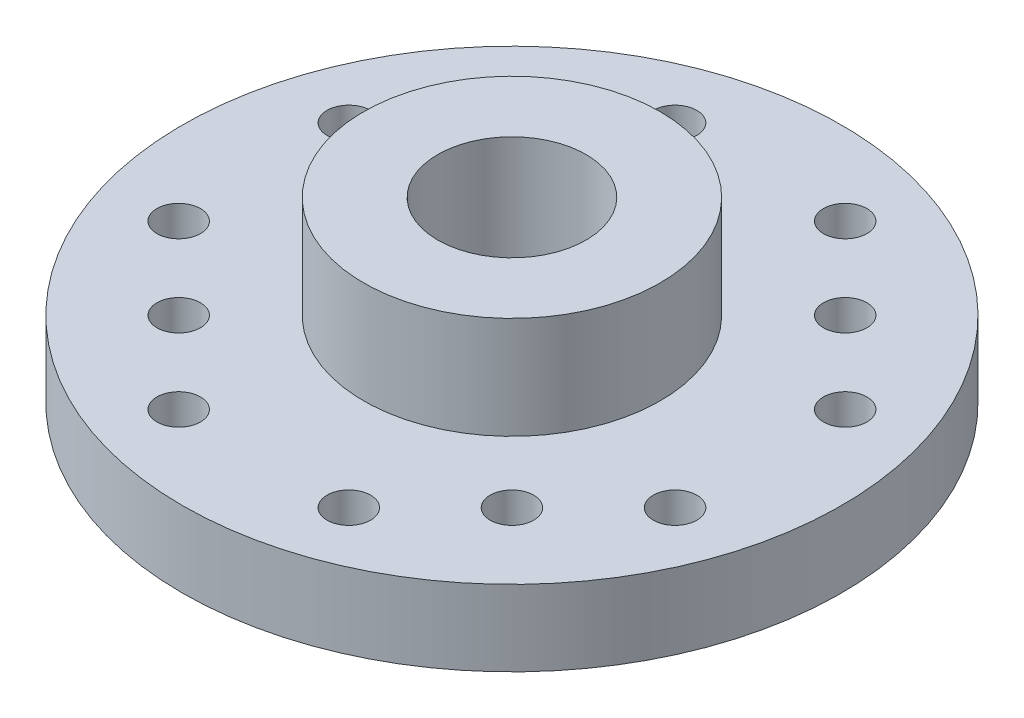
from build123d import *

# Parameters (mm, degrees)
SKETCH1_R           = 10
SKETCH1_R_2         = 0.66
SKETCH1_R_3         = 1.5
BOSS_EXTRUDE1_DEPTH = 2.3
SKETCH2_R           = 4.5
SKETCH2_R_2         = 1.5
BOSS_EXTRUDE2_DEPTH = 3.1
SKETCH3_R           = 2.25
CUT_EXTRUDE1_DEPTH  = 3.6
SKETCH_1_R          = 0.66
CUT_EXTRUDE_1_DEPTH = 16.138031576
SKETCH_2_R          = 4.375
SKETCH_2_R_2        = 3.2
SKETCH_2_R_3        = 2.7
SKETCH_2_R_4        = 1.5
CUT_EXTRUDE_2_DEPTH = 0.8


with BuildPart() as part:
    # Sketch1 → Boss-Extrude1 (new body)
    with BuildSketch(Plane(origin=(0, 0, 0), x_dir=(1, 0, 0), z_dir=(0, 1, 0))):
        with Locations(Location((0, 0, 0), (0, 0, 270))):
            Circle(SKETCH1_R)
        with Locations(Location((-5.055813485, 5.055813485, 0), (0, 0, 270))):
            Circle(SKETCH1_R_2, mode=Mode.SUBTRACT)
        with Locations(Location((5.055813485, 5.055813485, 0), (0, 0, 270))):
            Circle(SKETCH1_R_2, mode=Mode.SUBTRACT)
        with Locations(Location((5.055813485, -5.055813485, 0), (0, 0, 270))):
            Circle(SKETCH1_R_2, mode=Mode.SUBTRACT)
        with Locations(Location((-5.055813485, -5.055813485, 0), (0, 0, 270))):
            Circle(SKETCH1_R_2, mode=Mode.SUBTRACT)
        with Locations(Location((0, 0, 0), (0, 0, 270))):
            Circle(SKETCH1_R_3, mode=Mode.SUBTRACT)
    extrude(amount=BOSS_EXTRUDE1_DEPTH)

    # Sketch2 → Boss-Extrude2 (add)
    with BuildSketch(Plane(origin=(0, 2.3, 0), x_dir=(1, 0, 0), z_dir=(0, 1, 0))):
        with Locations(Location((0, 0, 0), (0, 0, 90))):
            Circle(SKETCH2_R)
        with Locations(Location((0, 0, 0), (0, 0, 270))):
            Circle(SKETCH2_R_2, mode=Mode.SUBTRACT)
    extrude(amount=BOSS_EXTRUDE2_DEPTH)

    # Sketch3 → Cut-Extrude1 (cut)
    with BuildSketch(Plane(origin=(0, 5.4, 0), x_dir=(1, 0, 0), z_dir=(0, 1, 0))):
        with Locations(Location((0, 0, 0), (0, 0, 270))):
            Circle(SKETCH3_R)
    extrude(amount=-CUT_EXTRUDE1_DEPTH, mode=Mode.SUBTRACT)

    # ｽｹｯﾁ1 → ｶｯﾄ - 押し出し1 (cut, through all)
    with BuildSketch(Plane(origin=(0, 0, 0), x_dir=(-1, 0, 0), z_dir=(0, -1, 0))):
        with Locations(Location((-2.580939751, -7.53068722, 0), (0, 0, 90))):
            Circle(SKETCH_1_R)
        with Locations(Location((-7.53068722, -2.580939751, 0), (0, 0, 90))):
            Circle(SKETCH_1_R)
        with Locations(Location((-7.53068722, 2.580939751, 0), (0, 0, 90))):
            Circle(SKETCH_1_R)
        with Locations(Location((-2.580939751, 7.53068722, 0), (0, 0, 90))):
            Circle(SKETCH_1_R)
        with Locations(Location((2.580939751, 7.53068722, 0), (0, 0, 90))):
            Circle(SKETCH_1_R)
        with Locations(Location((7.53068722, 2.580939751, 0), (0, 0, 90))):
            Circle(SKETCH_1_R)
        with Locations(Location((7.53068722, -2.580939751, 0), (0, 0, 90))):
            Circle(SKETCH_1_R)
        with Locations(Location((2.580939751, -7.53068722, 0), (0, 0, 90))):
            Circle(SKETCH_1_R)
    extrude(amount=-CUT_EXTRUDE_1_DEPTH, mode=Mode.SUBTRACT)

    # ｽｹｯﾁ2 → ｶｯﾄ - 押し出し2 (cut)
    # profile 1 of 2: a face of its own
    with BuildSketch(Plane(origin=(0, 0, 0), x_dir=(-1, 0, 0), z_dir=(0, -1, 0))):
        with Locations(Location((0, 0, 0), (0, 0, 90))):
            Circle(SKETCH_2_R)
        with Locations(Location((0, 0, 0), (0, 0, 90))):
            Circle(SKETCH_2_R_2, mode=Mode.SUBTRACT)
    # profile 2 of 2: a face of its own
    with BuildSketch(Plane(origin=(0, 0, 0), x_dir=(-1, 0, 0), z_dir=(0, -1, 0))):
        with Locations(Location((0, 0, 0), (0, 0, 90))):
            Circle(SKETCH_2_R_3)
        with Locations(Location((0, 0, 0), (0, 0, 90))):
            Circle(SKETCH_2_R_4, mode=Mode.SUBTRACT)
    extrude(amount=-CUT_EXTRUDE_2_DEPTH, mode=Mode.SUBTRACT)


solid = part.part
